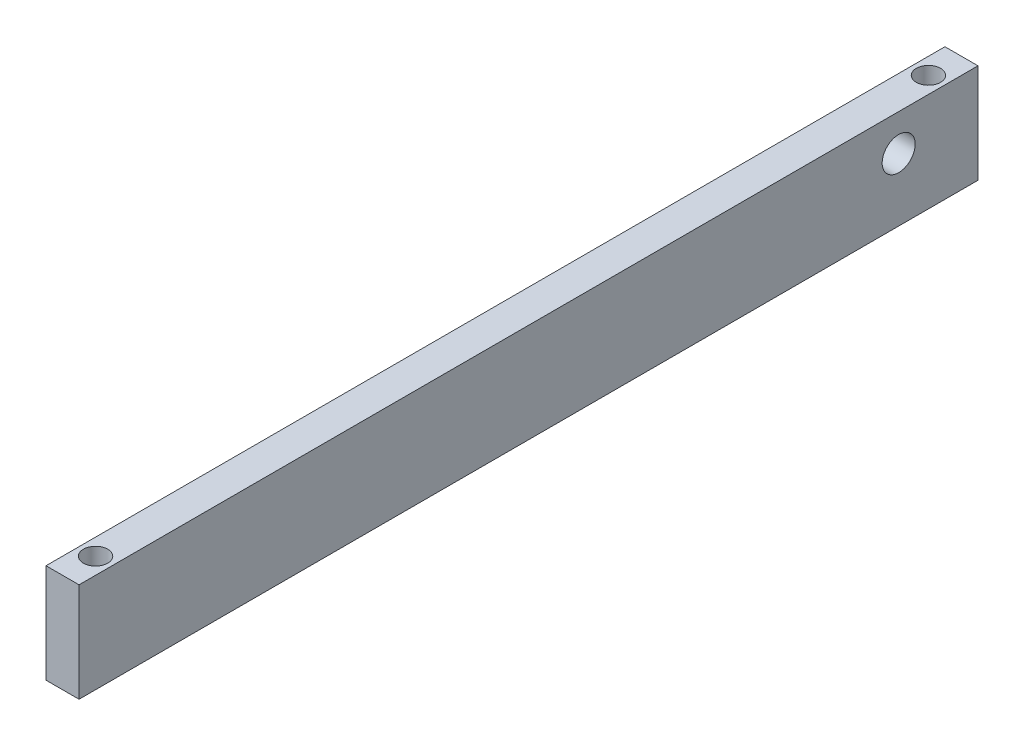
from build123d import *

# Parameters (mm, degrees)
SKETCH1_W           = 6.35
SKETCH1_H           = 19.05
BOSS_EXTRUDE1_DEPTH = 172.72
SKETCH4_R           = 3.175000102
CUT_EXTRUDE3_DEPTH  = 25.4
SKETCH2_R           = 2.3368
CUT_EXTRUDE4_DEPTH  = 174.883361481


with BuildPart() as part:
    # Sketch1 → Boss-Extrude1 (new body)
    with BuildSketch(Plane.XY):
        with Locations((-3.175, 9.525)):
            Rectangle(SKETCH1_W, SKETCH1_H)
    extrude(amount=BOSS_EXTRUDE1_DEPTH)

    # Sketch4 → Cut-Extrude3 (cut)
    with BuildSketch(Plane(origin=(0, 0, 0), x_dir=(0, 0, -1), z_dir=(1, 0, 0))):
        with Locations((-15.24, 12.065)):
            Circle(SKETCH4_R)
    extrude(amount=-CUT_EXTRUDE3_DEPTH, mode=Mode.SUBTRACT)

    # Sketch2 → Cut-Extrude4 (cut, through all)
    with BuildSketch(Plane(origin=(0, 19.05, 0), x_dir=(1, 0, 0), z_dir=(0, 1, 0))):
        with Locations(Location((-3.175, -166.37, 0), (0, 0, 270))):
            Circle(SKETCH2_R)
        with Locations(Location((-3.175, -6.35, 0), (0, 0, 270))):
            Circle(SKETCH2_R)
    extrude(amount=-CUT_EXTRUDE4_DEPTH, mode=Mode.SUBTRACT)


solid = part.part
